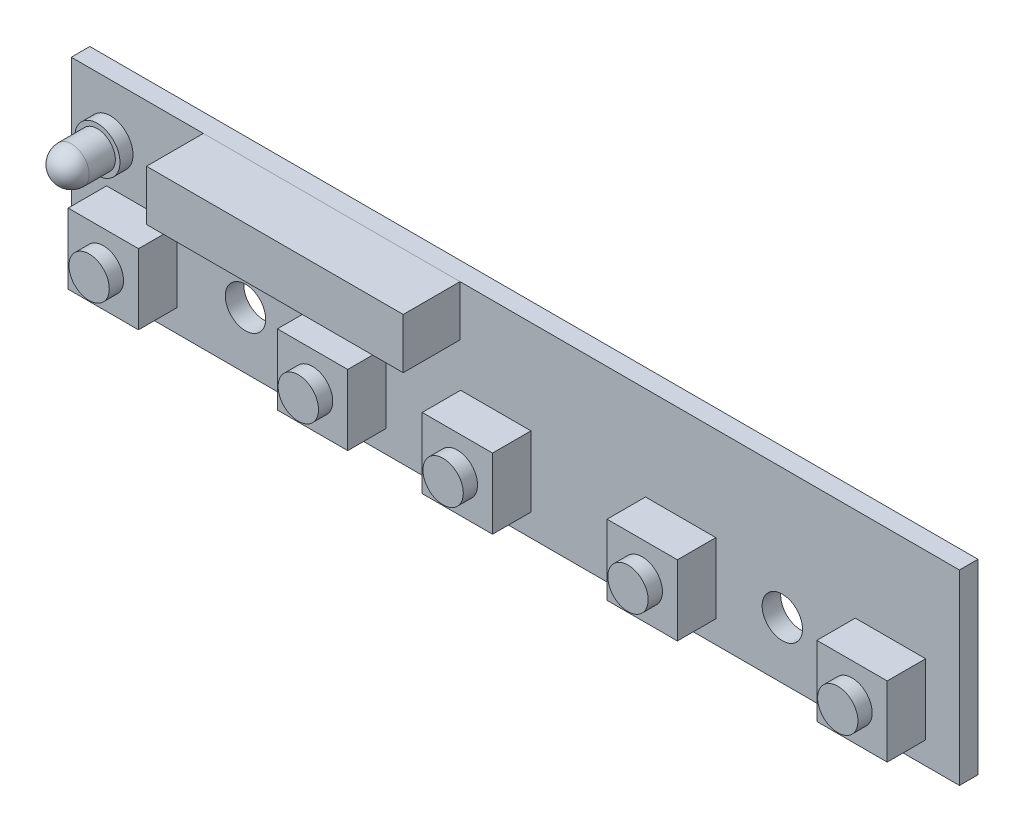
from build123d import *

# Parameters (mm, degrees)
SKETCH2_W             = 76.0222
SKETCH2_H             = 15.9766
SKETCH2_R             = 1.7272
BOSS_EXTRUDE1_DEPTH   = 1.5875
SKETCH3_W             = 6.0198
SKETCH3_H             = 6.0198
BOSS_EXTRUDE2_DEPTH   = 3.2893
BOSS_EXTRUDE2_2_DEPTH = 3.2893
BOSS_EXTRUDE2_3_DEPTH = 3.2893
BOSS_EXTRUDE2_4_DEPTH = 3.2893
BOSS_EXTRUDE2_5_DEPTH = 3.2893
SKETCH4_R             = 1.7272
BOSS_EXTRUDE3_DEPTH   = 1.2192
SKETCH5_W             = 21.971
SKETCH5_H             = 4.318
BOSS_EXTRUDE4_DEPTH   = 4.8641
BOSS_EXTRUDE5_START   = 0.889
SKETCH6_R             = 1.5367
BOSS_EXTRUDE5_DEPTH   = 3.3528
DOME1_FACE_RADIUS     = 1.5367
DOME1_HEIGHT          = 1.5367
SKETCH7_R             = 1.9304
BOSS_EXTRUDE6_DEPTH   = 1.1176


with BuildPart() as part:
    # Sketch2 → Boss-Extrude1 (new body)
    with BuildSketch(Plane.XY):
        Rectangle(SKETCH2_W, SKETCH2_H)
        with Locations((-23.1013, -3.1115)):
            Circle(SKETCH2_R, mode=Mode.SUBTRACT)
        with Locations((22.8473, -3.1115)):
            Circle(SKETCH2_R, mode=Mode.SUBTRACT)
    extrude(amount=-BOSS_EXTRUDE1_DEPTH)


with BuildPart() as body_2:
    # Sketch3 → Boss-Extrude2 (new body)
    with BuildSketch(Plane.XY):
        with Locations((-31.9786, -3.048)):
            Rectangle(SKETCH3_W, SKETCH3_H)
    extrude(amount=BOSS_EXTRUDE2_DEPTH)



with BuildPart() as body_3:
    # Sketch3 → Boss-Extrude2 2 (new body)
    with BuildSketch(Plane.XY):
        with Locations((-14.0716, -3.048)):
            Rectangle(SKETCH3_W, SKETCH3_H)
    extrude(amount=BOSS_EXTRUDE2_2_DEPTH)


with BuildPart() as body_4:
    # Sketch3 → Boss-Extrude2 3 (new body)
    with BuildSketch(Plane.XY):
        with Locations((-1.6764, -3.048)):
            Rectangle(SKETCH3_W, SKETCH3_H)
    extrude(amount=BOSS_EXTRUDE2_3_DEPTH)


with BuildPart() as body_5:
    # Sketch3 → Boss-Extrude2 4 (new body)
    with BuildSketch(Plane.XY):
        with Locations((14.1478, -3.048)):
            Rectangle(SKETCH3_W, SKETCH3_H)
    extrude(amount=BOSS_EXTRUDE2_4_DEPTH)


with BuildPart() as body_6:
    # Sketch3 → Boss-Extrude2 5 (new body)
    with BuildSketch(Plane.XY):
        with Locations((32.1056, -3.048)):
            Rectangle(SKETCH3_W, SKETCH3_H)
    extrude(amount=BOSS_EXTRUDE2_5_DEPTH)


with BuildPart() as body_2_1:
    add(body_2.part)

    add(body_3.part)  # Boss-Extrude3 merges body 3

    add(body_4.part)  # Boss-Extrude3 merges body 4

    add(body_5.part)  # Boss-Extrude3 merges body 5

    add(body_6.part)  # Boss-Extrude3 merges body 6
    # Sketch4 → Boss-Extrude3 (add)
    with BuildSketch(Plane.XY.offset(3.2893)):
        with Locations(Location((-31.9786, -3.048, 0), (0, 0, 180))):
            Circle(SKETCH4_R)
        with Locations(Location((-14.0716, -3.048, 0), (0, 0, 180))):
            Circle(SKETCH4_R)
        with Locations(Location((-1.6764, -3.048, 0), (0, 0, 180))):
            Circle(SKETCH4_R)
        with Locations((14.1478, -3.048)):
            Circle(SKETCH4_R)
        with Locations((32.1056, -3.048)):
            Circle(SKETCH4_R)
    extrude(amount=BOSS_EXTRUDE3_DEPTH)


with BuildPart() as body_3_2:
    # Sketch5 → Boss-Extrude4 (new body)
    with BuildSketch(Plane.XY):
        with Locations((-15.7226, 5.8293)):
            Rectangle(SKETCH5_W, SKETCH5_H)
    extrude(amount=BOSS_EXTRUDE4_DEPTH)


with BuildPart() as body_4_2:
    # Sketch6 → Boss-Extrude5 (new body)
    with BuildSketch(Plane.XY.offset(BOSS_EXTRUDE5_START)):
        with Locations((-33.7693, 4.2799)):
            Circle(SKETCH6_R)
    extrude(amount=BOSS_EXTRUDE5_DEPTH)

    # Dome1: a dome of height H over a round flat face of radius A is a cap of a sphere of radius (A * A + H * H) / (2 * H)
    dome1_r = (DOME1_FACE_RADIUS * DOME1_FACE_RADIUS + DOME1_HEIGHT * DOME1_HEIGHT) / (2 * DOME1_HEIGHT)
    dome1_base = Plane((-33.7693, 4.2799, 4.2418), z_dir=(0, 0, 1))
    with Locations(dome1_base.offset(DOME1_HEIGHT - dome1_r)):
        dome1_ball = Sphere(dome1_r, mode=Mode.PRIVATE)
    add(split(dome1_ball, bisect_by=dome1_base, keep=Keep.TOP, mode=Mode.PRIVATE))

    # Sketch7 → Boss-Extrude6 (add)
    with BuildSketch(Plane(origin=(0, 0, 0.889), x_dir=(-1, 0, 0), z_dir=(0, 0, -1))):
        with Locations((33.7693, 4.2799)):
            Circle(SKETCH7_R)
    extrude(amount=-BOSS_EXTRUDE6_DEPTH)


solid = Compound([part.part, body_2_1.part, body_3_2.part, body_4_2.part])
